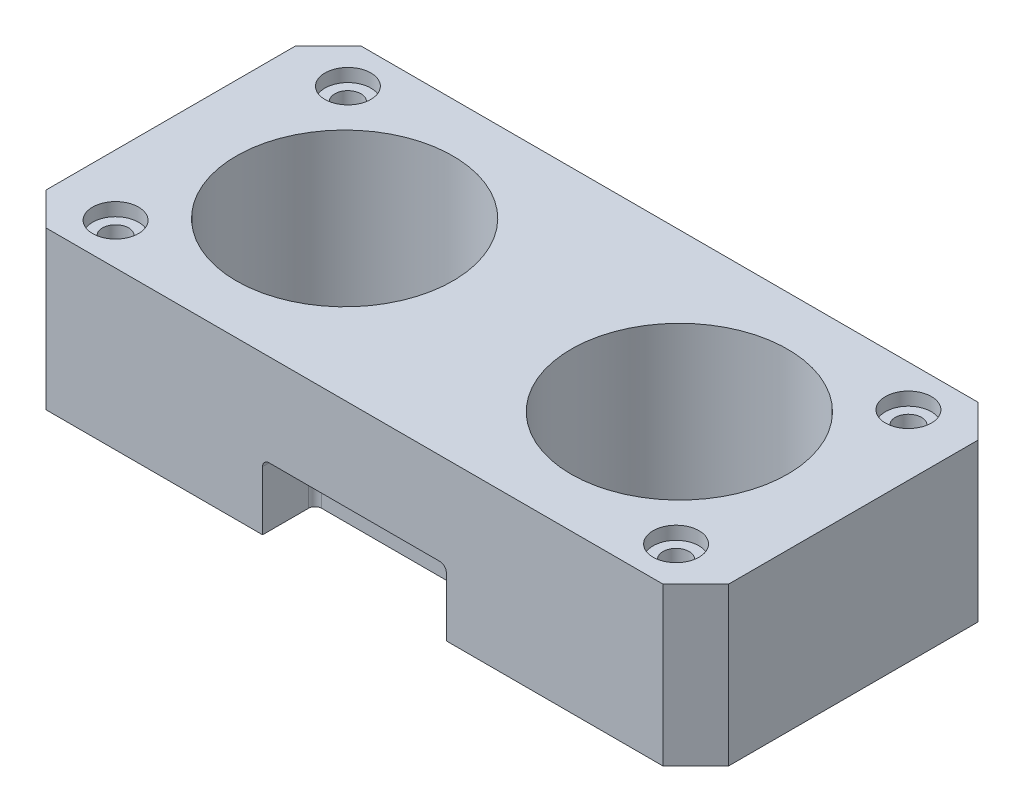
from build123d import *

# Parameters (mm, degrees)
SKETCH1_W           = 52
SKETCH1_H           = 24
SKETCH1_R           = 8.25
BOSS_EXTRUDE1_DEPTH = 12
SKETCH2_R           = 1
CUT_EXTRUDE1_DEPTH  = 32.048349393
SKETCH3_R           = 1.75
CUT_EXTRUDE2_DEPTH  = 1
CUT_EXTRUDE3_DEPTH  = 5
FILLET3_R           = 0.5
CHAMFER1_SIZE       = 2.5
SKETCH5_W           = 14
SKETCH5_H           = 8
CUT_EXTRUDE4_DEPTH  = 5
FILLET4_R           = 0.5


with BuildPart() as part:
    # Sketch1 → Boss-Extrude1 (new body)
    with BuildSketch(Plane(origin=(0, 0, 0), x_dir=(1, 0, 0), z_dir=(0, 1, 0))):
        Rectangle(SKETCH1_W, SKETCH1_H)
        with Locations(Location((12.75, 0, 0), (0, 0, 270))):
            Circle(SKETCH1_R, mode=Mode.SUBTRACT)
        with Locations(Location((-12.75, 0, 0), (0, 0, 270))):
            Circle(SKETCH1_R, mode=Mode.SUBTRACT)
    extrude(amount=BOSS_EXTRUDE1_DEPTH)

    # Sketch2 → Cut-Extrude1 (cut, through all)
    with BuildSketch(Plane(origin=(0, 12, 0), x_dir=(1, 0, 0), z_dir=(0, 1, 0))):
        with Locations(Location((-21.35, 8.85, 0), (0, 0, 270))):
            Circle(SKETCH2_R)
        with Locations(Location((21.35, 8.85, 0), (0, 0, 270))):
            Circle(SKETCH2_R)
        with Locations(Location((21.35, -8.85, 0), (0, 0, 270))):
            Circle(SKETCH2_R)
        with Locations(Location((-21.35, -8.85, 0), (0, 0, 270))):
            Circle(SKETCH2_R)
    extrude(amount=-CUT_EXTRUDE1_DEPTH, mode=Mode.SUBTRACT)

    # Sketch3 → Cut-Extrude2 (cut)
    with BuildSketch(Plane(origin=(0, 12, 0), x_dir=(1, 0, 0), z_dir=(0, 1, 0))):
        with Locations(Location((-21.35, 8.85, 0), (0, 0, 270))):
            Circle(SKETCH3_R)
        with Locations(Location((21.35, 8.85, 0), (0, 0, 270))):
            Circle(SKETCH3_R)
        with Locations(Location((21.35, -8.85, 0), (0, 0, 270))):
            Circle(SKETCH3_R)
        with Locations(Location((-21.35, -8.85, 0), (0, 0, 270))):
            Circle(SKETCH3_R)
    extrude(amount=-CUT_EXTRUDE2_DEPTH, mode=Mode.SUBTRACT)

    # Sketch4 → Cut-Extrude3 (cut)
    with BuildSketch(Plane.XZ):
        Polygon((-6, -5), (-6, -12), (6, -12), (6, -5), (0, -5), align=None)
    extrude(amount=-CUT_EXTRUDE3_DEPTH, mode=Mode.SUBTRACT)

    # Fillet3
    fillet3_edges = [part.edges().sort_by_distance(p)[0] for p in [
        (-6, 2.5, -5),
        (6, 5, -8.5),
        (6, 2.5, -5),
        (-6, 5, -8.5),
        (0, 5, -5),
    ]]
    fillet(fillet3_edges, radius=FILLET3_R)

    # Chamfer1
    chamfer1_edges = [part.edges().sort_by_distance(p)[0] for p in [
        (26, 6, 12),
        (-26, 6, 12),
        (-26, 6, -12),
        (26, 6, -12),
    ]]
    chamfer(chamfer1_edges, length=CHAMFER1_SIZE)

    # Sketch5 → Cut-Extrude4 (cut)
    with BuildSketch(Plane.XZ):
        with Locations((0, 12)):
            Rectangle(SKETCH5_W, SKETCH5_H)
    extrude(amount=-CUT_EXTRUDE4_DEPTH, mode=Mode.SUBTRACT)

    # Fillet4
    fillet4_edges = [part.edges().sort_by_distance(p)[0] for p in [
        (-7, 2.5, 8),
        (7, 5, 10),
        (0, 5, 8),
        (-7, 5, 10),
        (7, 2.5, 8),
    ]]
    fillet(fillet4_edges, radius=FILLET4_R)


solid = part.part
